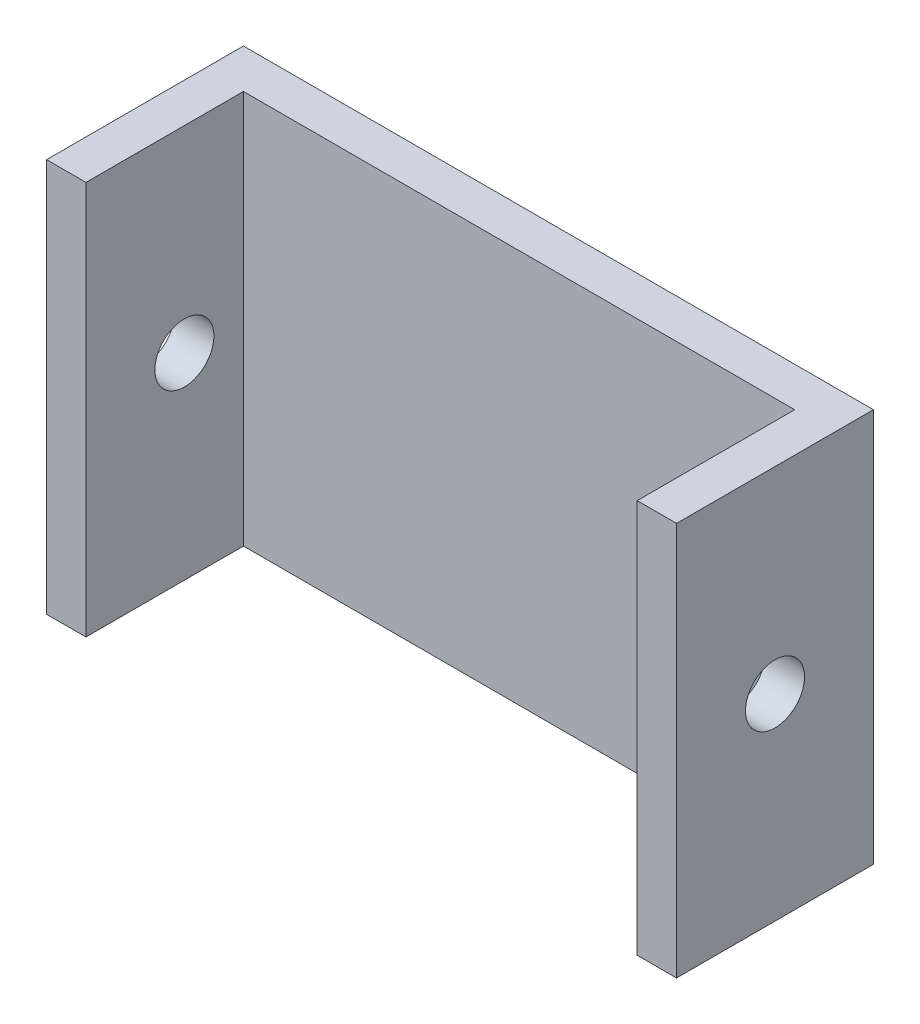
from build123d import *

# Parameters (mm, degrees)
ESQUISSE1_W                  = 28
ESQUISSE1_H                  = 20
BOSS_EXTRU_1_DEPTH           = 2
ESQUISSE2_W                  = 2
ESQUISSE2_H                  = 20
BOSS_EXTRU_2_DEPTH           = 10
ENL_V_MAT_EXTRU_1_DEPTH      = 22.354156504
ENL_V_MAT_EXTRU_1_DEPTH_BACK = 22.354156504
ESQUISSE3_R                  = 1.5
ESQUISSE4_W                  = 1.099038462
ESQUISSE4_H                  = 0.529166666
ENL_V_MAT_EXTRU_2_DEPTH      = 1


with BuildPart() as part:
    # Esquisse1 → Boss.-Extru.1 (new body)
    with BuildSketch(Plane.XY):
        Rectangle(ESQUISSE1_W, ESQUISSE1_H)
    extrude(amount=BOSS_EXTRU_1_DEPTH)

    # Esquisse2 → Boss.-Extru.2 (add)
    with BuildSketch(Plane.XY):
        with Locations((-15, 0)):
            Rectangle(ESQUISSE2_W, ESQUISSE2_H)
        with Locations((15, 0)):
            Rectangle(ESQUISSE2_W, ESQUISSE2_H)
    extrude(amount=BOSS_EXTRU_2_DEPTH)

    # Esquisse3 → Enlèv. mat.-Extru.1 (cut, two sides: drawn at the far end of the back side and taken through both)
    with BuildSketch(Plane(origin=(0, 0, 0), x_dir=(0, 0, -1), z_dir=(1, 0, 0)).offset(-ENL_V_MAT_EXTRU_1_DEPTH_BACK)):
        with Locations((-5, 0)):
            Circle(ESQUISSE3_R)
    extrude(amount=ENL_V_MAT_EXTRU_1_DEPTH + ENL_V_MAT_EXTRU_1_DEPTH_BACK, mode=Mode.SUBTRACT)

    # Esquisse4 → Enlèv. mat.-Extru.2 (cut)
    # profile 1 of 10: a face of its own
    with BuildSketch(Plane(origin=(0, 0, 0), x_dir=(-1, 0, 0), z_dir=(0, 0, -1))):
        Polygon((-14.382426883, 3.175), (-13.790930489, 3.175), (-13.06650641, 0.960386619), (-12.336994191, 3.175), (-11.751221955, 3.175), (-11.214423077, 0), (-11.791291066, 0), (-12.130288462, 2.005363582), (-12.79047476, 0), (-13.346354167, 0), (-14.002724359, 2.005363582), (-14.341085737, 0), (-14.918589744, 0), align=None)
    # profile 2 of 10: a face of its own
    with BuildSketch(Plane(origin=(0, 0, 0), x_dir=(-1, 0, 0), z_dir=(0, 0, -1))):
        with BuildLine():
            Line((-7.958012821, 0.452208534), (-7.419305889, -0.244230769))
            Line((-7.419305889, -0.244230769), (-8.128465545, -0.244230769))
            Line((-8.128465545, -0.244230769), (-8.407677284, 0.116391226))
            add(Edge.make_bspline(
                [(-8.407677284, 0.116391226), (-8.436923867, 0.100466187), (-8.495279076, 0.068691228), (-8.586787742, 0.029068108), (-8.679990398, -0.005692185), (-8.776237577, -0.032930336), (-8.874605223, -0.054370068), (-8.975603022, -0.070739654), (-9.079158703, -0.079370973), (-9.149047866, -0.080727101), (-9.184254808, -0.081410256)],
                knots=[0, 0, 0, 0, 0.985706899, 1.966764212, 2.949968678, 3.929638882, 4.925906056, 5.930211904, 6.957336097, 8, 8, 8, 8], degree=3))
            add(Edge.make_bspline(
                [(-9.184254808, -0.081410256), (-9.242859715, -0.080094869), (-9.357805858, -0.077514902), (-9.526147519, -0.052742163), (-9.687300674, -0.01534206), (-9.840667131, 0.039301405), (-9.986763562, 0.10874107), (-10.124422049, 0.194794933), (-10.255243795, 0.295077116), (-10.37602809, 0.410571809), (-10.486543835, 0.535731796), (-10.583108174, 0.66870483), (-10.665194204, 0.807416247), (-10.732137682, 0.952083639), (-10.784193041, 1.102956411), (-10.820646997, 1.259622481), (-10.843758221, 1.422298361), (-10.846622918, 1.532724268), (-10.848076923, 1.588772035)],
                knots=[0, 0, 0, 0, 1.070144486, 2.098953612, 3.10240755, 4.088674545, 5.067611437, 6.052256776, 7.0494179, 8.074208254, 9.100739571, 10.09639475, 11.072322686, 12.041159829, 13.004031207, 13.983083054, 14.976293755, 16, 16, 16, 16], degree=3))
            add(Edge.make_bspline(
                [(-10.848076923, 1.588772035), (-10.847592214, 1.626327381), (-10.846628933, 1.700962536), (-10.835043388, 1.811570612), (-10.818327857, 1.92000964), (-10.793785207, 2.025696745), (-10.763522437, 2.12940729), (-10.725017212, 2.230316673), (-10.680393258, 2.32938311), (-10.629199705, 2.425783598), (-10.571050731, 2.518092805), (-10.509258594, 2.607044208), (-10.44052463, 2.68978176), (-10.367281634, 2.768168735), (-10.289289031, 2.842153791), (-10.205318552, 2.910211938), (-10.116965871, 2.974032133), (-10.023594389, 3.032276403), (-9.926825064, 3.084923569), (-9.827548543, 3.130677527), (-9.726520447, 3.169819583), (-9.623703082, 3.201705354), (-9.5187837, 3.225600525), (-9.412685506, 3.2437941), (-9.304446436, 3.253914479), (-9.231763487, 3.255572932), (-9.195067107, 3.256410256)],
                knots=[0, 0, 0, 0, 1.035855852, 2.058595393, 3.065553363, 4.06176554, 5.050183643, 6.044349766, 7.039272903, 8.046842428, 9.053256483, 10.04817962, 11.033146707, 12.018200652, 13.007259073, 13.996749908, 14.99846043, 16.012935138, 17.03119782, 18.036301871, 19.027088812, 20.018894167, 21.003704893, 21.994284571, 22.987348552, 24, 24, 24, 24], degree=3))
            add(Edge.make_bspline(
                [(-9.195067107, 3.256410256), (-9.139649678, 3.255001093), (-9.03044954, 3.252224334), (-8.869816845, 3.228480547), (-8.714911908, 3.190657267), (-8.566373477, 3.136010037), (-8.423293684, 3.067107178), (-8.287098509, 2.981850891), (-8.156346756, 2.881999288), (-8.033863117, 2.767504419), (-7.920670205, 2.643249914), (-7.821992695, 2.50993868), (-7.738456246, 2.370116061), (-7.668790529, 2.223726313), (-7.616305103, 2.069913898), (-7.578836807, 1.909700032), (-7.555120466, 1.742971999), (-7.552362935, 1.629345392), (-7.550961538, 1.571599559)],
                knots=[0, 0, 0, 0, 1.015551519, 2.00114601, 2.970254478, 3.93428303, 4.897362978, 5.876714212, 6.874912676, 7.909046156, 8.946527051, 9.952474942, 10.9443724, 11.928494229, 12.919233427, 13.917651329, 14.941735923, 16, 16, 16, 16], degree=3))
            add(Edge.make_bspline(
                [(-7.550961538, 1.571599559), (-7.552126601, 1.518324576), (-7.55441805, 1.413543185), (-7.574269513, 1.259073676), (-7.605603555, 1.11018576), (-7.650606884, 0.966773627), (-7.707638456, 0.828993593), (-7.778699966, 0.697255836), (-7.860642853, 0.56999636), (-7.925394355, 0.491666883), (-7.958012821, 0.452208534)],
                knots=[0, 0, 0, 0, 1.049646143, 2.064447078, 3.064298101, 4.044929938, 5.022708814, 5.998521441, 6.991758374, 8, 8, 8, 8], degree=3))
        make_face()
        with BuildLine():
            add(Edge.make_bspline(
                [(-8.331991186, 0.936853966), (-8.315027893, 0.961174078), (-8.281492128, 1.009253985), (-8.239058558, 1.085515257), (-8.202607642, 1.163262448), (-8.172464162, 1.242903528), (-8.149534051, 1.324894907), (-8.133235845, 1.408701319), (-8.12244288, 1.494361144), (-8.121372654, 1.552062342), (-8.120833333, 1.581139824)],
                knots=[0, 0, 0, 0, 1.031533623, 2.039301536, 3.033003023, 4.018477747, 4.999688364, 5.992485227, 6.988348989, 8, 8, 8, 8], degree=3))
            add(Edge.make_bspline(
                [(-8.120833333, 1.581139824), (-8.121837097, 1.61892283), (-8.123812852, 1.693292914), (-8.138652355, 1.802618034), (-8.163512375, 1.907390986), (-8.198175942, 2.007868214), (-8.241829216, 2.104307641), (-8.296666952, 2.195906242), (-8.361094089, 2.283139766), (-8.434488695, 2.365168117), (-8.514396154, 2.440242217), (-8.599379677, 2.506360438), (-8.688856307, 2.562140444), (-8.782878386, 2.607179158), (-8.880426001, 2.643454645), (-8.982545987, 2.667802938), (-9.088348253, 2.68376733), (-9.160450839, 2.685606706), (-9.19697516, 2.686538462)],
                knots=[0, 0, 0, 0, 1.056263418, 2.079093448, 3.078410197, 4.062632158, 5.04680056, 6.032966551, 7.041959893, 8.074807684, 9.106532056, 10.103754224, 11.080880922, 12.048629763, 13.014470275, 13.984975, 14.979267944, 16, 16, 16, 16], degree=3))
            add(Edge.make_bspline(
                [(-9.19697516, 2.686538462), (-9.234551191, 2.685555352), (-9.308508861, 2.683620382), (-9.4170851, 2.668494694), (-9.521232645, 2.644769489), (-9.620404053, 2.609934883), (-9.714899597, 2.566042518), (-9.804714942, 2.512185734), (-9.889399968, 2.448062961), (-9.969156019, 2.375552409), (-10.0412184, 2.295091877), (-10.104853743, 2.208811209), (-10.158114874, 2.116918458), (-10.202719121, 2.020250439), (-10.2362968, 1.917724644), (-10.260213025, 1.810142959), (-10.275327225, 1.697320349), (-10.277232385, 1.620409309), (-10.278205128, 1.581139824)],
                knots=[0, 0, 0, 0, 1.042613217, 2.052085894, 3.036973397, 4.002832266, 4.963730975, 5.924467509, 6.903642813, 7.907474205, 8.911719447, 9.896835452, 10.877830278, 11.85475743, 12.846581833, 13.865885605, 14.910357018, 16, 16, 16, 16], degree=3))
            add(Edge.make_bspline(
                [(-10.278205128, 1.581139824), (-10.276915703, 1.537620201), (-10.274388642, 1.452328951), (-10.256600021, 1.327911765), (-10.226186676, 1.210399284), (-10.182197655, 1.100425933), (-10.127839055, 0.996443324), (-10.05935651, 0.900666097), (-9.979723898, 0.811200516), (-9.918253289, 0.759123602), (-9.887054287, 0.732692308)],
                knots=[0, 0, 0, 0, 1.078047314, 2.112794111, 3.106520711, 4.077995885, 5.041371964, 6.006121678, 6.988020189, 8, 8, 8, 8], degree=3))
            add(Edge.make_bspline(
                [(-9.887054287, 0.732692308), (-9.861527566, 0.713126434), (-9.810905924, 0.674325655), (-9.729814505, 0.625211693), (-9.646700569, 0.582546176), (-9.560778229, 0.548435559), (-9.472344308, 0.521307518), (-9.381417611, 0.502515818), (-9.287820526, 0.490554097), (-9.224572614, 0.489165288), (-9.192523037, 0.488461538)],
                knots=[0, 0, 0, 0, 1.027457745, 2.037535419, 3.025615023, 4.011018129, 4.9886297, 5.978868484, 6.975833209, 8, 8, 8, 8], degree=3))
            add(Edge.make_bspline(
                [(-9.192523037, 0.488461538), (-9.155751209, 0.489632394), (-9.082765899, 0.491956327), (-8.975338005, 0.512199851), (-8.87066838, 0.542474506), (-8.805048811, 0.573420844), (-8.772115385, 0.588952324)],
                knots=[0, 0, 0, 0, 1.010952568, 2.006554787, 2.999521277, 4, 4, 4, 4], degree=3))
            Line((-8.772115385, 0.588952324), (-9.323542668, 1.302564103))
            Line((-9.323542668, 1.302564103), (-8.614383013, 1.302564103))
            Line((-8.614383013, 1.302564103), (-8.331991186, 0.936853966))
        make_face(mode=Mode.SUBTRACT)
    # profile 3 of 10: a face of its own
    with BuildSketch(Plane(origin=(0, 0, 0), x_dir=(-1, 0, 0), z_dir=(0, 0, -1))):
        with Locations((-6.431570513, 1.160096154)):
            Rectangle(ESQUISSE4_W, ESQUISSE4_H)
    # profile 4 of 10: a face of its own
    with BuildSketch(Plane(origin=(0, 0, 0), x_dir=(-1, 0, 0), z_dir=(0, 0, -1))):
        with BuildLine():
            Line((-4.266566506, 3.256410256), (-3.762204527, 3.00073117))
            Line((-3.762204527, 3.00073117), (-4.315539864, 1.913141026))
            add(Edge.make_bspline(
                [(-4.315539864, 1.913141026), (-4.282849331, 1.912294651), (-4.218459967, 1.910627578), (-4.123724082, 1.897154014), (-4.033154812, 1.873861453), (-3.945838952, 1.842987227), (-3.862843855, 1.801522834), (-3.782832839, 1.752198775), (-3.707875829, 1.69204278), (-3.636254126, 1.62539313), (-3.571128879, 1.551554895), (-3.514556088, 1.472213367), (-3.4652539, 1.389298934), (-3.426928363, 1.300956598), (-3.396013709, 1.208650736), (-3.373707425, 1.11201236), (-3.360981066, 1.010761626), (-3.359226525, 0.941977417), (-3.358333333, 0.906961138)],
                knots=[0, 0, 0, 0, 1.013260694, 1.995783107, 2.958651975, 3.908806537, 4.861209129, 5.829647963, 6.817170299, 7.835534541, 8.860094905, 9.863329007, 10.853101798, 11.844815043, 12.84250023, 13.867713965, 14.914507806, 16, 16, 16, 16], degree=3))
            add(Edge.make_bspline(
                [(-3.358333333, 0.906961138), (-3.359170328, 0.873207569), (-3.360824707, 0.806491238), (-3.374500344, 0.708501914), (-3.396600891, 0.614486889), (-3.428187011, 0.524633922), (-3.468335523, 0.438503809), (-3.517434435, 0.356147091), (-3.575890925, 0.278179194), (-3.64219464, 0.205014401), (-3.714676039, 0.138324152), (-3.791075381, 0.079045977), (-3.872040066, 0.030079955), (-3.956039764, -0.011272998), (-4.044620963, -0.042131259), (-4.136458041, -0.065423901), (-4.232247424, -0.078864766), (-4.297266802, -0.08055497), (-4.330168269, -0.081410256)],
                knots=[0, 0, 0, 0, 1.049934834, 2.075270938, 3.072134561, 4.05064612, 5.033440221, 6.024524368, 7.028587226, 8.060776465, 9.092543989, 10.090062252, 11.064205434, 12.031961459, 12.998029633, 13.977230324, 14.976426867, 16, 16, 16, 16], degree=3))
            add(Edge.make_bspline(
                [(-4.330168269, -0.081410256), (-4.364573205, -0.080708368), (-4.432225857, -0.0793282), (-4.531218617, -0.063873954), (-4.626161194, -0.040609741), (-4.716519995, -0.007392398), (-4.802856935, 0.034903587), (-4.884155551, 0.087240616), (-4.961100672, 0.149041549), (-5.032871951, 0.218915965), (-5.097532524, 0.295453826), (-5.155204351, 0.374920054), (-5.203994791, 0.457439347), (-5.243489515, 0.542923478), (-5.274304215, 0.631100047), (-5.295744961, 0.722136406), (-5.309715586, 0.81579108), (-5.311353323, 0.879350442), (-5.312179487, 0.911413261)],
                knots=[0, 0, 0, 0, 1.063775006, 2.091769615, 3.092589432, 4.084662827, 5.064601646, 6.061867366, 7.070035304, 8.113879863, 9.156342271, 10.166834137, 11.149076039, 12.117706134, 13.076241869, 14.034148791, 15.008317125, 16, 16, 16, 16], degree=3))
            add(Edge.make_bspline(
                [(-5.312179487, 0.911413261), (-5.311742958, 0.936242164), (-5.310867471, 0.986038176), (-5.302069342, 1.060604999), (-5.288693097, 1.135367552), (-5.273188278, 1.198454562), (-5.257222981, 1.251801232), (-5.241153787, 1.296947076), (-5.221239562, 1.347049092), (-5.198474653, 1.40223522), (-5.172143186, 1.462439071), (-5.142382713, 1.527496544), (-5.109119142, 1.597900304), (-5.085397635, 1.646256786), (-5.073036859, 1.671454327)],
                knots=[0, 0, 0, 0, 1.110454016, 2.227089276, 3.35462975, 4.507227546, 5.131400587, 5.845402449, 6.650387134, 7.543487832, 8.516250726, 9.590168902, 10.744287919, 12, 12, 12, 12], degree=3))
            Line((-5.073036859, 1.671454327), (-4.266566506, 3.256410256))
        make_face()
        with BuildLine():
            add(Edge.make_bspline(
                [(-4.342888622, 1.383974359), (-4.370232805, 1.382720139), (-4.423741782, 1.380265795), (-4.499823545, 1.354562713), (-4.569192851, 1.314240974), (-4.629323024, 1.258085155), (-4.67961638, 1.190976745), (-4.716573703, 1.114430641), (-4.738805587, 1.029468327), (-4.741115337, 0.970064094), (-4.742307692, 0.939398037)],
                knots=[0, 0, 0, 0, 0.981744412, 1.921144944, 2.858899012, 3.85339082, 4.86292663, 5.863643845, 6.897155691, 8, 8, 8, 8], degree=3))
            add(Edge.make_bspline(
                [(-4.742307692, 0.939398037), (-4.740895907, 0.908721768), (-4.738149889, 0.849054373), (-4.715082057, 0.763283067), (-4.677312859, 0.684998689), (-4.624343968, 0.617000948), (-4.56215925, 0.560557558), (-4.493203774, 0.518814972), (-4.418627741, 0.493171132), (-4.367041678, 0.490042243), (-4.340980569, 0.488461538)],
                knots=[0, 0, 0, 0, 1.098279937, 2.136227893, 3.159405121, 4.194678092, 5.206500211, 6.154139736, 7.067477469, 8, 8, 8, 8], degree=3))
            add(Edge.make_bspline(
                [(-4.340980569, 0.488461538), (-4.313457092, 0.490070396), (-4.259478773, 0.493225646), (-4.181611508, 0.51779044), (-4.110479295, 0.558833701), (-4.047584658, 0.615096382), (-3.993559361, 0.682318178), (-3.956179312, 0.761062388), (-3.932045045, 0.847452761), (-3.929513798, 0.908062449), (-3.928205128, 0.939398037)],
                knots=[0, 0, 0, 0, 0.96921794, 1.900804717, 2.848419905, 3.844199796, 4.861108892, 5.867439427, 6.897452859, 8, 8, 8, 8], degree=3))
            add(Edge.make_bspline(
                [(-3.928205128, 0.939398037), (-3.929695943, 0.970046189), (-3.932583079, 1.029399913), (-3.954268892, 1.114760256), (-3.992987446, 1.191011323), (-4.044418731, 1.258362168), (-4.106618265, 1.314492947), (-4.178763872, 1.354880703), (-4.258321177, 1.380220258), (-4.314288474, 1.382704747), (-4.342888622, 1.383974359)],
                knots=[0, 0, 0, 0, 1.083229974, 2.097801324, 3.086792542, 4.086858909, 5.079819718, 6.026392613, 6.991456328, 8, 8, 8, 8], degree=3))
        make_face(mode=Mode.SUBTRACT)
    # profile 5 of 10: a face of its own
    with BuildSketch(Plane(origin=(0, 0, 0), x_dir=(-1, 0, 0), z_dir=(0, 0, -1))):
        with BuildLine():
            Line((0.142307692, 2.750776242), (-0.283824119, 2.360897436))
            add(Edge.make_bspline(
                [(-0.283824119, 2.360897436), (-0.302077778, 2.38664612), (-0.337122259, 2.436080004), (-0.393925707, 2.502273139), (-0.450472659, 2.558740809), (-0.507286986, 2.605247119), (-0.564872271, 2.641509507), (-0.623128554, 2.667183679), (-0.681725562, 2.683504993), (-0.721093707, 2.68553739), (-0.740484776, 2.686538462)],
                knots=[0, 0, 0, 0, 1.299362458, 2.494594718, 3.587462134, 4.587049575, 5.512617175, 6.380583204, 7.202344345, 8, 8, 8, 8], degree=3))
            add(Edge.make_bspline(
                [(-0.740484776, 2.686538462), (-0.758572209, 2.685904137), (-0.79349429, 2.684679422), (-0.843278307, 2.672505847), (-0.887477267, 2.651496044), (-0.926048033, 2.62402396), (-0.95660177, 2.590926467), (-0.980996559, 2.556215707), (-0.994732876, 2.517902879), (-0.996540845, 2.491588082), (-0.997435897, 2.478560697)],
                knots=[0, 0, 0, 0, 1.185010067, 2.2879431, 3.333075148, 4.379039566, 5.372662701, 6.27520591, 7.14612461, 8, 8, 8, 8], degree=3))
            add(Edge.make_bspline(
                [(-0.997435897, 2.478560697), (-0.996875014, 2.465345451), (-0.995745472, 2.438731783), (-0.984835633, 2.399726137), (-0.968391391, 2.36161308), (-0.952678246, 2.338411849), (-0.944646434, 2.326552484)],
                knots=[0, 0, 0, 0, 0.967525499, 1.948461899, 2.951351359, 4, 4, 4, 4], degree=3))
            add(Edge.make_bspline(
                [(-0.944646434, 2.326552484), (-0.937344649, 2.317334324), (-0.920536902, 2.296115336), (-0.888487972, 2.262507766), (-0.848241247, 2.221335552), (-0.798247948, 2.174014485), (-0.740583434, 2.118842714), (-0.672574881, 2.057989063), (-0.596179871, 1.989568965), (-0.541880068, 1.941923686), (-0.513426482, 1.916957131)],
                knots=[0, 0, 0, 0, 0.473873513, 1.090794244, 1.870441696, 2.795289791, 3.865433203, 5.087734844, 6.473946851, 8, 8, 8, 8], degree=3))
            add(Edge.make_bspline(
                [(-0.513426482, 1.916957131), (-0.486718699, 1.893842892), (-0.436032876, 1.849976869), (-0.363917015, 1.787716092), (-0.300539184, 1.731701589), (-0.244976112, 1.682774018), (-0.198070082, 1.640420016), (-0.159623901, 1.604437133), (-0.129168012, 1.575525888), (-0.111855623, 1.558063478), (-0.104467147, 1.550610978)],
                knots=[0, 0, 0, 0, 1.543621617, 2.929473131, 4.163658386, 5.240097082, 6.164993805, 6.925417477, 7.541396219, 8, 8, 8, 8], degree=3))
            add(Edge.make_bspline(
                [(-0.104467147, 1.550610978), (-0.07643681, 1.520276149), (-0.022552658, 1.461961956), (0.047477745, 1.371593297), (0.105115031, 1.283375058), (0.149704329, 1.195647272), (0.18337996, 1.1071442), (0.207121726, 1.01569531), (0.221340828, 0.920345018), (0.22291948, 0.855280084), (0.223717949, 0.822370793)],
                knots=[0, 0, 0, 0, 1.206664779, 2.319633467, 3.337109185, 4.282041471, 5.190008762, 6.099243693, 7.03861361, 8, 8, 8, 8], degree=3))
            add(Edge.make_bspline(
                [(0.223717949, 0.822370793), (0.223149619, 0.790304725), (0.222034535, 0.727389906), (0.208376894, 0.63532344), (0.188901899, 0.547211837), (0.15879014, 0.464013874), (0.122090107, 0.384363884), (0.076081314, 0.309502559), (0.022050297, 0.238672272), (-0.039877546, 0.173139201), (-0.108377093, 0.113672482), (-0.181849367, 0.060733804), (-0.261012818, 0.017026182), (-0.345191085, -0.018963927), (-0.434339109, -0.04668399), (-0.528350688, -0.0671717), (-0.62736962, -0.079468101), (-0.695080192, -0.080753544), (-0.729672476, -0.081410256)],
                knots=[0, 0, 0, 0, 1.043214005, 2.046824704, 3.02475056, 3.976699089, 4.921714032, 5.875962561, 6.831408892, 7.817874052, 8.806269674, 9.781291748, 10.760897367, 11.74438705, 12.757449933, 13.795994037, 14.874007457, 16, 16, 16, 16], degree=3))
            add(Edge.make_bspline(
                [(-0.729672476, -0.081410256), (-0.756827124, -0.080928515), (-0.810608901, -0.07997439), (-0.889875108, -0.072184758), (-0.966415592, -0.059613119), (-1.040144137, -0.041594206), (-1.111392902, -0.018761799), (-1.180164813, 0.009127112), (-1.245985116, 0.042504794), (-1.309351837, 0.080684869), (-1.369956937, 0.125016965), (-1.428566743, 0.174594728), (-1.484599087, 0.230180684), (-1.538323081, 0.291643377), (-1.589394983, 0.359156853), (-1.63948656, 0.431780861), (-1.686371593, 0.510863206), (-1.715334563, 0.566340111), (-1.730128205, 0.594676482)],
                knots=[0, 0, 0, 0, 1.016823716, 2.013894106, 2.979844003, 3.91962641, 4.853723003, 5.779685073, 6.695824784, 7.614987388, 8.547259901, 9.504950863, 10.487499108, 11.500346958, 12.559593716, 13.656357062, 14.802919212, 16, 16, 16, 16], degree=3))
            Line((-1.730128205, 0.594676482), (-1.228946314, 0.895512821))
            add(Edge.make_bspline(
                [(-1.228946314, 0.895512821), (-1.210441679, 0.863347337), (-1.174966711, 0.801683355), (-1.114851062, 0.71882998), (-1.053265649, 0.647879779), (-0.988786672, 0.590086802), (-0.922198171, 0.544678281), (-0.853178508, 0.512226202), (-0.781679192, 0.492138402), (-0.732977106, 0.489685218), (-0.708683894, 0.488461538)],
                knots=[0, 0, 0, 0, 1.283663364, 2.460892379, 3.537111102, 4.529833553, 5.449777664, 6.316464042, 7.160231139, 8, 8, 8, 8], degree=3))
            add(Edge.make_bspline(
                [(-0.708683894, 0.488461538), (-0.68397422, 0.489460861), (-0.636033853, 0.491399693), (-0.567605114, 0.509308096), (-0.504867056, 0.537425604), (-0.450636741, 0.577545409), (-0.40471793, 0.623849762), (-0.370827211, 0.675365473), (-0.349536834, 0.731104227), (-0.347285924, 0.769824033), (-0.346153846, 0.789297877)],
                knots=[0, 0, 0, 0, 1.13588714, 2.203786484, 3.234766741, 4.283437687, 5.291419208, 6.222934724, 7.106237994, 8, 8, 8, 8], degree=3))
            add(Edge.make_bspline(
                [(-0.346153846, 0.789297877), (-0.347199274, 0.807415119), (-0.349322961, 0.844218563), (-0.364965384, 0.898939365), (-0.389419262, 0.953635282), (-0.418349925, 0.998498352), (-0.447790496, 1.036060985), (-0.475942323, 1.068607307), (-0.510223801, 1.104565296), (-0.550548007, 1.143980182), (-0.596382154, 1.187198947), (-0.647764851, 1.234217356), (-0.705284483, 1.284621236), (-0.745939473, 1.31895586), (-0.767197516, 1.336909054)],
                knots=[0, 0, 0, 0, 0.916159276, 1.861089862, 2.860218735, 3.940849679, 4.552606315, 5.27541173, 6.11797699, 7.06649574, 8.129236253, 9.306560635, 10.591630461, 12, 12, 12, 12], degree=3))
            add(Edge.make_bspline(
                [(-0.767197516, 1.336909054), (-0.807609902, 1.371101808), (-0.885173501, 1.436728051), (-0.994780708, 1.533655946), (-1.093546616, 1.624243946), (-1.180618176, 1.709611915), (-1.257104814, 1.788183306), (-1.32248853, 1.860596305), (-1.376051054, 1.92740948), (-1.432414061, 2.006545214), (-1.485970187, 2.102977544), (-1.532257877, 2.218996816), (-1.562287377, 2.335001367), (-1.565651765, 2.412880433), (-1.567307692, 2.451211939)],
                knots=[0, 0, 0, 0, 1.345494975, 2.582412109, 3.71882943, 4.751509156, 5.681369928, 6.505683931, 7.230279997, 7.856715994, 8.973648664, 10.023341002, 11.027102913, 12, 12, 12, 12], degree=3))
            add(Edge.make_bspline(
                [(-1.567307692, 2.451211939), (-1.566618994, 2.478394586), (-1.565262186, 2.53194732), (-1.553159242, 2.610688812), (-1.535070932, 2.686667736), (-1.508801513, 2.759606886), (-1.474706979, 2.829414903), (-1.433300492, 2.896433526), (-1.383939087, 2.960045931), (-1.328312117, 3.020209948), (-1.267025437, 3.075193012), (-1.201532831, 3.123721076), (-1.132204994, 3.164708584), (-1.059466037, 3.198710699), (-0.982865227, 3.224737157), (-0.90296688, 3.243186008), (-0.819656395, 3.254158796), (-0.762990401, 3.25565042), (-0.734124599, 3.256410256)],
                knots=[0, 0, 0, 0, 1.010766082, 1.991317756, 2.957454644, 3.913069143, 4.869106762, 5.843196583, 6.838735724, 7.860187025, 8.887984031, 9.89767229, 10.887916223, 11.879572884, 12.879850636, 13.892031539, 14.926195476, 16, 16, 16, 16], degree=3))
            add(Edge.make_bspline(
                [(-0.734124599, 3.256410256), (-0.696715949, 3.255041768), (-0.622193938, 3.252315594), (-0.512010996, 3.230997805), (-0.404388905, 3.197473336), (-0.317665007, 3.157029753), (-0.248660421, 3.117852034), (-0.195774851, 3.081782126), (-0.141960937, 3.040462108), (-0.086784703, 2.993761769), (-0.031271409, 2.940801214), (0.026157453, 2.88284121), (0.084719346, 2.819380848), (0.122775291, 2.774045059), (0.142307692, 2.750776242)],
                knots=[0, 0, 0, 0, 1.282922637, 2.555718331, 3.837320111, 5.142675274, 5.830281639, 6.55870424, 7.337177975, 8.157850921, 9.037902056, 9.96903443, 10.957596896, 12, 12, 12, 12], degree=3))
        make_face()
    # profile 6 of 10: a face of its own
    with BuildSketch(Plane(origin=(0, 0, 0), x_dir=(-1, 0, 0), z_dir=(0, 0, -1))):
        Polygon((0.793589744, 3.175), (2.503205128, 3.175), (2.503205128, 2.605128205), (1.363461538, 2.605128205), (1.363461538, 1.994551282), (2.503205128, 1.994551282), (2.503205128, 1.424679487), (1.363461538, 1.424679487), (1.363461538, 0.569871795), (2.503205128, 0.569871795), (2.503205128, 0), (0.793589744, 0), align=None)
    # profile 7 of 10: a face of its own
    with BuildSketch(Plane(origin=(0, 0, 0), x_dir=(-1, 0, 0), z_dir=(0, 0, -1))):
        Polygon((3.073076923, 3.175), (3.586343149, 3.175), (5.026923077, 1.085682091), (5.026923077, 3.175), (5.596794872, 3.175), (5.596794872, 0), (5.07971254, 0), (3.642948718, 2.082957732), (3.642948718, 0), (3.073076923, 0), align=None)
    # profile 8 of 10: a face of its own
    with BuildSketch(Plane(origin=(0, 0, 0), x_dir=(-1, 0, 0), z_dir=(0, 0, -1))):
        with BuildLine():
            Line((7.957692308, 2.750776242), (7.531560497, 2.360897436))
            add(Edge.make_bspline(
                [(7.531560497, 2.360897436), (7.513306837, 2.38664612), (7.478262356, 2.436080004), (7.421458908, 2.502273139), (7.364911957, 2.558740809), (7.308097629, 2.605247119), (7.250512344, 2.641509507), (7.192256062, 2.667183679), (7.133659053, 2.683504993), (7.094290909, 2.68553739), (7.07489984, 2.686538462)],
                knots=[0, 0, 0, 0, 1.299362458, 2.494594718, 3.587462134, 4.587049575, 5.512617175, 6.380583204, 7.202344345, 8, 8, 8, 8], degree=3))
            add(Edge.make_bspline(
                [(7.07489984, 2.686538462), (7.056812407, 2.685904137), (7.021890326, 2.684679422), (6.972106308, 2.672505847), (6.927907348, 2.651496044), (6.889336583, 2.62402396), (6.858782846, 2.590926467), (6.834388056, 2.556215707), (6.82065174, 2.517902879), (6.81884377, 2.491588082), (6.817948718, 2.478560697)],
                knots=[0, 0, 0, 0, 1.185010067, 2.2879431, 3.333075148, 4.379039566, 5.372662701, 6.27520591, 7.14612461, 8, 8, 8, 8], degree=3))
            add(Edge.make_bspline(
                [(6.817948718, 2.478560697), (6.818509602, 2.465345451), (6.819639144, 2.438731783), (6.830548983, 2.399726137), (6.846993225, 2.36161308), (6.862706369, 2.338411849), (6.870738181, 2.326552484)],
                knots=[0, 0, 0, 0, 0.967525499, 1.948461899, 2.951351359, 4, 4, 4, 4], degree=3))
            add(Edge.make_bspline(
                [(6.870738181, 2.326552484), (6.878039967, 2.317334324), (6.894847713, 2.296115336), (6.926896643, 2.262507766), (6.967143369, 2.221335552), (7.017136668, 2.174014485), (7.074801182, 2.118842714), (7.142809735, 2.057989063), (7.219204745, 1.989568965), (7.273504548, 1.941923686), (7.301958133, 1.916957131)],
                knots=[0, 0, 0, 0, 0.473873513, 1.090794244, 1.870441696, 2.795289791, 3.865433203, 5.087734844, 6.473946851, 8, 8, 8, 8], degree=3))
            add(Edge.make_bspline(
                [(7.301958133, 1.916957131), (7.328665916, 1.893842892), (7.379351739, 1.849976869), (7.4514676, 1.787716092), (7.514845432, 1.731701589), (7.570408503, 1.682774018), (7.617314533, 1.640420016), (7.655760715, 1.604437133), (7.686216603, 1.575525888), (7.703528992, 1.558063478), (7.710917468, 1.550610978)],
                knots=[0, 0, 0, 0, 1.543621617, 2.929473131, 4.163658386, 5.240097082, 6.164993805, 6.925417477, 7.541396219, 8, 8, 8, 8], degree=3))
            add(Edge.make_bspline(
                [(7.710917468, 1.550610978), (7.738947805, 1.520276149), (7.792831957, 1.461961956), (7.86286236, 1.371593297), (7.920499646, 1.283375058), (7.965088944, 1.195647272), (7.998764575, 1.1071442), (8.022506341, 1.01569531), (8.036725443, 0.920345018), (8.038304095, 0.855280084), (8.039102564, 0.822370793)],
                knots=[0, 0, 0, 0, 1.206664779, 2.319633467, 3.337109185, 4.282041471, 5.190008762, 6.099243693, 7.03861361, 8, 8, 8, 8], degree=3))
            add(Edge.make_bspline(
                [(8.039102564, 0.822370793), (8.038534234, 0.790304725), (8.03741915, 0.727389906), (8.023761509, 0.63532344), (8.004286514, 0.547211837), (7.974174755, 0.464013874), (7.937474722, 0.384363884), (7.89146593, 0.309502559), (7.837434912, 0.238672272), (7.77550707, 0.173139201), (7.707007522, 0.113672482), (7.633535248, 0.060733804), (7.554371797, 0.017026182), (7.470193531, -0.018963927), (7.381045506, -0.04668399), (7.287033927, -0.0671717), (7.188014995, -0.079468101), (7.120304423, -0.080753544), (7.085712139, -0.081410256)],
                knots=[0, 0, 0, 0, 1.043214005, 2.046824704, 3.02475056, 3.976699089, 4.921714032, 5.875962561, 6.831408892, 7.817874052, 8.806269674, 9.781291748, 10.760897367, 11.74438705, 12.757449933, 13.795994037, 14.874007457, 16, 16, 16, 16], degree=3))
            add(Edge.make_bspline(
                [(7.085712139, -0.081410256), (7.058557491, -0.080928515), (7.004775715, -0.07997439), (6.925509507, -0.072184758), (6.848969023, -0.059613119), (6.775240479, -0.041594206), (6.703991714, -0.018761799), (6.635219802, 0.009127112), (6.569399499, 0.042504794), (6.506032778, 0.080684869), (6.445427678, 0.125016965), (6.386817872, 0.174594728), (6.330785528, 0.230180684), (6.277061535, 0.291643377), (6.225989632, 0.359156853), (6.175898055, 0.431780861), (6.129013023, 0.510863206), (6.100050052, 0.566340111), (6.08525641, 0.594676482)],
                knots=[0, 0, 0, 0, 1.016823716, 2.013894106, 2.979844003, 3.91962641, 4.853723003, 5.779685073, 6.695824784, 7.614987388, 8.547259901, 9.504950863, 10.487499108, 11.500346958, 12.559593716, 13.656357062, 14.802919212, 16, 16, 16, 16], degree=3))
            Line((6.08525641, 0.594676482), (6.586438301, 0.895512821))
            add(Edge.make_bspline(
                [(6.586438301, 0.895512821), (6.604942937, 0.863347337), (6.640417904, 0.801683355), (6.700533553, 0.71882998), (6.762118966, 0.647879779), (6.826597944, 0.590086802), (6.893186445, 0.544678281), (6.962206107, 0.512226202), (7.033705423, 0.492138402), (7.08240751, 0.489685218), (7.106700721, 0.488461538)],
                knots=[0, 0, 0, 0, 1.283663364, 2.460892379, 3.537111102, 4.529833553, 5.449777664, 6.316464042, 7.160231139, 8, 8, 8, 8], degree=3))
            add(Edge.make_bspline(
                [(7.106700721, 0.488461538), (7.131410395, 0.489460861), (7.179350762, 0.491399693), (7.247779501, 0.509308096), (7.31051756, 0.537425604), (7.364747874, 0.577545409), (7.410666685, 0.623849762), (7.444557404, 0.675365473), (7.465847782, 0.731104227), (7.468098691, 0.769824033), (7.469230769, 0.789297877)],
                knots=[0, 0, 0, 0, 1.13588714, 2.203786484, 3.234766741, 4.283437687, 5.291419208, 6.222934724, 7.106237994, 8, 8, 8, 8], degree=3))
            add(Edge.make_bspline(
                [(7.469230769, 0.789297877), (7.468185341, 0.807415119), (7.466061654, 0.844218563), (7.450419231, 0.898939365), (7.425965353, 0.953635282), (7.397034691, 0.998498352), (7.367594119, 1.036060985), (7.339442293, 1.068607307), (7.305160815, 1.104565296), (7.264836608, 1.143980182), (7.219002461, 1.187198947), (7.167619765, 1.234217356), (7.110100132, 1.284621236), (7.069445142, 1.31895586), (7.048187099, 1.336909054)],
                knots=[0, 0, 0, 0, 0.916159276, 1.861089862, 2.860218735, 3.940849679, 4.552606315, 5.27541173, 6.11797699, 7.06649574, 8.129236253, 9.306560635, 10.591630461, 12, 12, 12, 12], degree=3))
            add(Edge.make_bspline(
                [(7.048187099, 1.336909054), (7.007774714, 1.371101808), (6.930211114, 1.436728051), (6.820603907, 1.533655946), (6.721837999, 1.624243946), (6.63476644, 1.709611915), (6.558279801, 1.788183306), (6.492896085, 1.860596305), (6.439333561, 1.92740948), (6.382970554, 2.006545214), (6.329414428, 2.102977544), (6.283126738, 2.218996816), (6.253097238, 2.335001367), (6.24973285, 2.412880433), (6.248076923, 2.451211939)],
                knots=[0, 0, 0, 0, 1.345494975, 2.582412109, 3.71882943, 4.751509156, 5.681369928, 6.505683931, 7.230279997, 7.856715994, 8.973648664, 10.023341002, 11.027102913, 12, 12, 12, 12], degree=3))
            add(Edge.make_bspline(
                [(6.248076923, 2.451211939), (6.248765621, 2.478394586), (6.25012243, 2.53194732), (6.262225373, 2.610688812), (6.280313683, 2.686667736), (6.306583102, 2.759606886), (6.340677636, 2.829414903), (6.382084123, 2.896433526), (6.431445528, 2.960045931), (6.487072499, 3.020209948), (6.548359178, 3.075193012), (6.613851784, 3.123721076), (6.683179622, 3.164708584), (6.755918579, 3.198710699), (6.832519388, 3.224737157), (6.912417736, 3.243186008), (6.995728221, 3.254158796), (7.052394214, 3.25565042), (7.081260016, 3.256410256)],
                knots=[0, 0, 0, 0, 1.010766082, 1.991317756, 2.957454644, 3.913069143, 4.869106762, 5.843196583, 6.838735724, 7.860187025, 8.887984031, 9.89767229, 10.887916223, 11.879572884, 12.879850636, 13.892031539, 14.926195476, 16, 16, 16, 16], degree=3))
            add(Edge.make_bspline(
                [(7.081260016, 3.256410256), (7.118668667, 3.255041768), (7.193190677, 3.252315594), (7.303373619, 3.230997805), (7.41099571, 3.197473336), (7.497719608, 3.157029753), (7.566724195, 3.117852034), (7.619609764, 3.081782126), (7.673423678, 3.040462108), (7.728599912, 2.993761769), (7.784113206, 2.940801214), (7.841542069, 2.88284121), (7.900103961, 2.819380848), (7.938159906, 2.774045059), (7.957692308, 2.750776242)],
                knots=[0, 0, 0, 0, 1.282922637, 2.555718331, 3.837320111, 5.142675274, 5.830281639, 6.55870424, 7.337177975, 8.157850921, 9.037902056, 9.96903443, 10.957596896, 12, 12, 12, 12], degree=3))
        make_face()
    # profile 9 of 10: a face of its own
    with BuildSketch(Plane(origin=(0, 0, 0), x_dir=(-1, 0, 0), z_dir=(0, 0, -1))):
        with BuildLine():
            add(Edge.make_bspline(
                [(10.101071715, 3.256410256), (10.156272981, 3.254980997), (10.265252783, 3.252159315), (10.425522746, 3.228638391), (10.579972488, 3.190314418), (10.728532169, 3.137041323), (10.870829812, 3.067376201), (11.007367349, 2.983294103), (11.137655708, 2.883208031), (11.260359799, 2.769452826), (11.373760509, 2.645749008), (11.472022291, 2.512559855), (11.555816334, 2.373336432), (11.62526506, 2.227705686), (11.678163192, 2.074659054), (11.715283999, 1.914976872), (11.739132279, 1.748704567), (11.741875198, 1.635495791), (11.743269231, 1.577959736)],
                knots=[0, 0, 0, 0, 1.014329547, 2.002516266, 2.970391464, 3.935626869, 4.897733899, 5.877609409, 6.878433252, 7.912639331, 8.949961323, 9.958554974, 10.949718813, 11.932905612, 12.9188844, 13.919928257, 14.942845884, 16, 16, 16, 16], degree=3))
            add(Edge.make_bspline(
                [(11.743269231, 1.577959736), (11.741784646, 1.521071978), (11.738859225, 1.408972828), (11.716257591, 1.244232788), (11.678511664, 1.086261135), (11.626510726, 0.934700295), (11.558321537, 0.790284378), (11.476161569, 0.652091308), (11.377862778, 0.521403549), (11.267010507, 0.398291235), (11.144971776, 0.286540392), (11.015713386, 0.188060155), (10.879832174, 0.104611718), (10.737527025, 0.036233306), (10.588492773, -0.016832662), (10.433097551, -0.054274558), (10.271350974, -0.077028754), (10.161355459, -0.079935067), (10.105523838, -0.081410256)],
                knots=[0, 0, 0, 0, 1.051557043, 2.072126891, 3.067553643, 4.050577992, 5.02905126, 6.015227836, 7.017913613, 8.04756643, 9.074058332, 10.072836633, 11.047628519, 12.017157415, 12.98668631, 13.966869689, 14.968021931, 16, 16, 16, 16], degree=3))
            add(Edge.make_bspline(
                [(10.105523838, -0.081410256), (10.047130658, -0.080086939), (9.932396039, -0.077486802), (9.764481412, -0.052760683), (9.60360469, -0.01551451), (9.45111733, 0.040073406), (9.30546638, 0.109562974), (9.167721978, 0.195143543), (9.037930418, 0.296673685), (8.916836203, 0.411553175), (8.807124551, 0.537256535), (8.710282498, 0.670050986), (8.628594078, 0.808922098), (8.562056303, 0.953934863), (8.509600593, 1.104188064), (8.47259905, 1.260596786), (8.450741356, 1.422785903), (8.447696706, 1.532947994), (8.446153846, 1.588772035)],
                knots=[0, 0, 0, 0, 1.067978421, 2.098431617, 3.099715153, 4.085208694, 5.062210972, 6.048429807, 7.046490867, 8.072918869, 9.098532598, 10.095778865, 11.076610158, 12.041847152, 13.011192615, 13.984257998, 14.978533688, 16, 16, 16, 16], degree=3))
            add(Edge.make_bspline(
                [(8.446153846, 1.588772035), (8.446638084, 1.626327528), (8.447600429, 1.700962974), (8.459192889, 1.811568896), (8.475882697, 1.920015938), (8.500566132, 2.025871722), (8.530550197, 2.12988301), (8.569398788, 2.231081639), (8.613618999, 2.330548689), (8.665286151, 2.427109331), (8.722735028, 2.519875124), (8.785416868, 2.608408477), (8.853489284, 2.691638892), (8.926732991, 2.770113325), (9.005400397, 2.843315958), (9.088456714, 2.912283076), (9.177512751, 2.975182667), (9.27061935, 3.033550865), (9.367251598, 3.086332215), (9.467016114, 3.13125812), (9.567857552, 3.170491149), (9.671123017, 3.201455589), (9.775705837, 3.226675803), (9.882723267, 3.243354362), (9.991208465, 3.2549465), (10.064363722, 3.25592118), (10.101071715, 3.256410256)],
                knots=[0, 0, 0, 0, 1.034744296, 2.056386356, 3.06226378, 4.057406941, 5.050368692, 6.043467995, 7.042652155, 8.049140477, 9.059438543, 10.048523776, 11.036952808, 12.020949711, 13.004946614, 13.997082645, 14.994316842, 16.007702937, 17.024872941, 18.026463647, 19.021641123, 20.005082605, 20.995858141, 21.984425357, 22.988620895, 24, 24, 24, 24], degree=3))
        make_face()
        with BuildLine():
            add(Edge.make_bspline(
                [(10.092167468, 2.686538462), (10.055017023, 2.685541632), (9.981696911, 2.683574288), (9.87414966, 2.668585794), (9.770900501, 2.644647465), (9.672521784, 2.609973087), (9.578587129, 2.565841405), (9.488930018, 2.51240662), (9.404792016, 2.44783197), (9.325051225, 2.375584181), (9.253018542, 2.295083541), (9.189375394, 2.208813414), (9.13611633, 2.116917871), (9.09151153, 2.020250599), (9.057934002, 1.9177246), (9.034017735, 1.810142972), (9.018903547, 1.697320346), (9.016998385, 1.620409308), (9.016025641, 1.581139824)],
                knots=[0, 0, 0, 0, 1.033739768, 2.040188636, 3.016340934, 3.979330865, 4.937572243, 5.900995986, 6.878200029, 7.884839167, 8.891893314, 9.879764717, 10.863503415, 11.843163062, 12.837761627, 13.859916423, 14.907309254, 16, 16, 16, 16], degree=3))
            add(Edge.make_bspline(
                [(9.016025641, 1.581139824), (9.017315351, 1.537620401), (9.019842968, 1.452329544), (9.037627592, 1.32790954), (9.068055314, 1.210407195), (9.111992352, 1.100397195), (9.166485806, 0.996657962), (9.234158028, 0.900460967), (9.313913047, 0.811230227), (9.375355667, 0.759133605), (9.406540465, 0.732692308)],
                knots=[0, 0, 0, 0, 1.078454662, 2.113592447, 3.107694534, 4.079536787, 5.043276885, 6.005368276, 6.987637804, 8, 8, 8, 8], degree=3))
            add(Edge.make_bspline(
                [(9.406540465, 0.732692308), (9.432086767, 0.713158493), (9.48260381, 0.674530963), (9.563240009, 0.625021859), (9.646279416, 0.582587618), (9.732348667, 0.548301253), (9.821265988, 0.521332175), (9.913019187, 0.502446173), (10.007478257, 0.490593574), (10.071355906, 0.489176964), (10.103615785, 0.488461538)],
                knots=[0, 0, 0, 0, 1.023928204, 2.024787132, 3.009472467, 3.9914905, 4.972207045, 5.96565515, 6.972602802, 8, 8, 8, 8], degree=3))
            add(Edge.make_bspline(
                [(10.103615785, 0.488461538), (10.140127427, 0.48946682), (10.211965231, 0.491444744), (10.317510432, 0.506248722), (10.418625941, 0.531302397), (10.51593949, 0.565672599), (10.609170471, 0.610358393), (10.697863239, 0.665450558), (10.782173297, 0.730272633), (10.861812499, 0.803469193), (10.934606495, 0.88428695), (10.998116833, 0.971017233), (11.053069269, 1.061749113), (11.096746511, 1.157766763), (11.131650612, 1.258163822), (11.155279034, 1.363384925), (11.170520902, 1.472996313), (11.172426601, 1.547590736), (11.173397436, 1.585591947)],
                knots=[0, 0, 0, 0, 1.026359118, 2.019393844, 2.989460624, 3.950973911, 4.916101784, 5.890408035, 6.881132271, 7.902007068, 8.92769091, 9.933912415, 10.920395702, 11.90457117, 12.894218921, 13.903490204, 14.931958862, 16, 16, 16, 16], degree=3))
            add(Edge.make_bspline(
                [(11.173397436, 1.585591947), (11.17239301, 1.623374641), (11.170415951, 1.697744112), (11.155585917, 1.807073689), (11.130691125, 1.911830273), (11.096217714, 2.012184941), (11.052196992, 2.108236078), (10.997760905, 2.199645912), (10.93310046, 2.286326071), (10.859703815, 2.367685865), (10.779816078, 2.442450303), (10.694048609, 2.507332245), (10.60480128, 2.56371259), (10.510026321, 2.607878675), (10.411662748, 2.643065702), (10.309110341, 2.668977933), (10.201980677, 2.683468994), (10.129098152, 2.685506185), (10.092167468, 2.686538462)],
                knots=[0, 0, 0, 0, 1.055025985, 2.07665775, 3.074803781, 4.057872707, 5.035505728, 6.020516407, 7.023567878, 8.050795229, 9.077271434, 10.074415901, 11.050397877, 12.019801805, 12.988065821, 13.964604439, 14.968634123, 16, 16, 16, 16], degree=3))
        make_face(mode=Mode.SUBTRACT)
    # profile 10 of 10: a face of its own
    with BuildSketch(Plane(origin=(0, 0, 0), x_dir=(-1, 0, 0), z_dir=(0, 0, -1))):
        with BuildLine():
            Line((12.313141026, 3.175), (12.977143429, 3.175))
            add(Edge.make_bspline(
                [(12.977143429, 3.175), (13.021033786, 3.174844214), (13.105447306, 3.174544595), (13.22716699, 3.169817392), (13.338983259, 3.163239101), (13.441061667, 3.153200455), (13.533358544, 3.139890424), (13.615966391, 3.124200099), (13.688882796, 3.10631761), (13.752722706, 3.084034619), (13.810335068, 3.058899742), (13.864037799, 3.030019307), (13.915015662, 2.997714908), (13.962927923, 2.961136528), (14.008190953, 2.920942202), (14.050890141, 2.877091473), (14.090422111, 2.829212502), (14.126542077, 2.777607826), (14.159462518, 2.72332089), (14.188557284, 2.666277157), (14.212217196, 2.606436959), (14.233123264, 2.544665114), (14.248181228, 2.480078583), (14.258653821, 2.413306125), (14.266321445, 2.344112696), (14.266762296, 2.297105753), (14.266987179, 2.273127003)],
                knots=[0, 0, 0, 0, 1.749336639, 3.364467119, 4.854658419, 6.213483162, 7.451590619, 8.570285859, 9.5643256, 10.440900261, 11.26203566, 12.067320669, 12.869050712, 13.665104639, 14.467235401, 15.27997916, 16.102287765, 16.939272006, 17.78853747, 18.631303466, 19.488103222, 20.351255419, 21.228522269, 22.127379805, 23.044756219, 24, 24, 24, 24], degree=3))
            add(Edge.make_bspline(
                [(14.266987179, 2.273127003), (14.266403014, 2.248098697), (14.265257571, 2.199022751), (14.259087595, 2.126934188), (14.247810817, 2.057964894), (14.230730496, 1.992316801), (14.211098885, 1.929172843), (14.184993878, 1.869698066), (14.155531799, 1.813027495), (14.120540547, 1.759962756), (14.082139358, 1.709325176), (14.037479583, 1.663054868), (13.989454489, 1.618664978), (13.935364411, 1.578935939), (13.87759369, 1.541181417), (13.814994483, 1.506965765), (13.747975333, 1.475428881), (13.700857551, 1.457841737), (13.676762821, 1.448848157)],
                knots=[0, 0, 0, 0, 1.099860209, 2.156625411, 3.176576793, 4.16617041, 5.135385252, 6.078461593, 7.016046972, 7.938469504, 8.868247731, 9.803980173, 10.76021508, 11.73834243, 12.748633912, 13.790971185, 14.870363756, 16, 16, 16, 16], degree=3))
            Line((13.676762821, 1.448848157), (14.409455128, 0))
            Line((14.409455128, 0), (13.775981571, 0))
            Line((13.775981571, 0), (13.076362179, 1.383974359))
            Line((13.076362179, 1.383974359), (12.883012821, 1.383974359))
            Line((12.883012821, 1.383974359), (12.883012821, 0))
            Line((12.883012821, 0), (12.313141026, 0))
            Line((12.313141026, 0), (12.313141026, 3.175))
        make_face()
        with BuildLine():
            Line((12.883012821, 1.953846154), (13.104982973, 1.953846154))
            add(Edge.make_bspline(
                [(13.104982973, 1.953846154), (13.132120669, 1.954151797), (13.184083526, 1.954737037), (13.25881294, 1.957451626), (13.326685069, 1.963992443), (13.38799138, 1.972256521), (13.443040361, 1.981798593), (13.491340994, 1.99547296), (13.533637518, 2.010125392), (13.569428718, 2.028334563), (13.600007897, 2.04904234), (13.62641106, 2.072566889), (13.648250262, 2.09979356), (13.666225039, 2.129982448), (13.680207462, 2.163400567), (13.690413559, 2.199681062), (13.696117258, 2.239237214), (13.696773488, 2.266536345), (13.697115385, 2.280759215)],
                knots=[0, 0, 0, 0, 1.688639943, 3.233382647, 4.650958383, 5.928841754, 7.082724185, 8.122798841, 9.049171256, 9.863274652, 10.613301712, 11.341792392, 12.054588806, 12.776240173, 13.521029143, 14.301969904, 15.115324896, 16, 16, 16, 16], degree=3))
            add(Edge.make_bspline(
                [(13.697115385, 2.280759215), (13.696468998, 2.297585908), (13.695199292, 2.33063883), (13.68259986, 2.378223447), (13.662544286, 2.422266266), (13.635053587, 2.46256829), (13.600432626, 2.497899827), (13.560702342, 2.529044858), (13.515005259, 2.553672018), (13.472693199, 2.56991583), (13.434199114, 2.579634671), (13.399459417, 2.586877065), (13.359230639, 2.592009958), (13.313482409, 2.597454304), (13.262331341, 2.600984687), (13.205498631, 2.603561163), (13.143147503, 2.604615326), (13.099682844, 2.604952323), (13.076998197, 2.605128205)],
                knots=[0, 0, 0, 0, 1.020303359, 2.004196876, 2.966617323, 3.9489082, 4.950758222, 5.960522915, 7.003732012, 8.091992268, 8.70421221, 9.413913587, 10.24622431, 11.166358409, 12.212345909, 13.359657661, 14.621978493, 16, 16, 16, 16], degree=3))
            Line((13.076998197, 2.605128205), (12.883012821, 2.605128205))
            Line((12.883012821, 2.605128205), (12.883012821, 1.953846154))
        make_face(mode=Mode.SUBTRACT)
    extrude(amount=-ENL_V_MAT_EXTRU_2_DEPTH, mode=Mode.SUBTRACT)


solid = part.part
